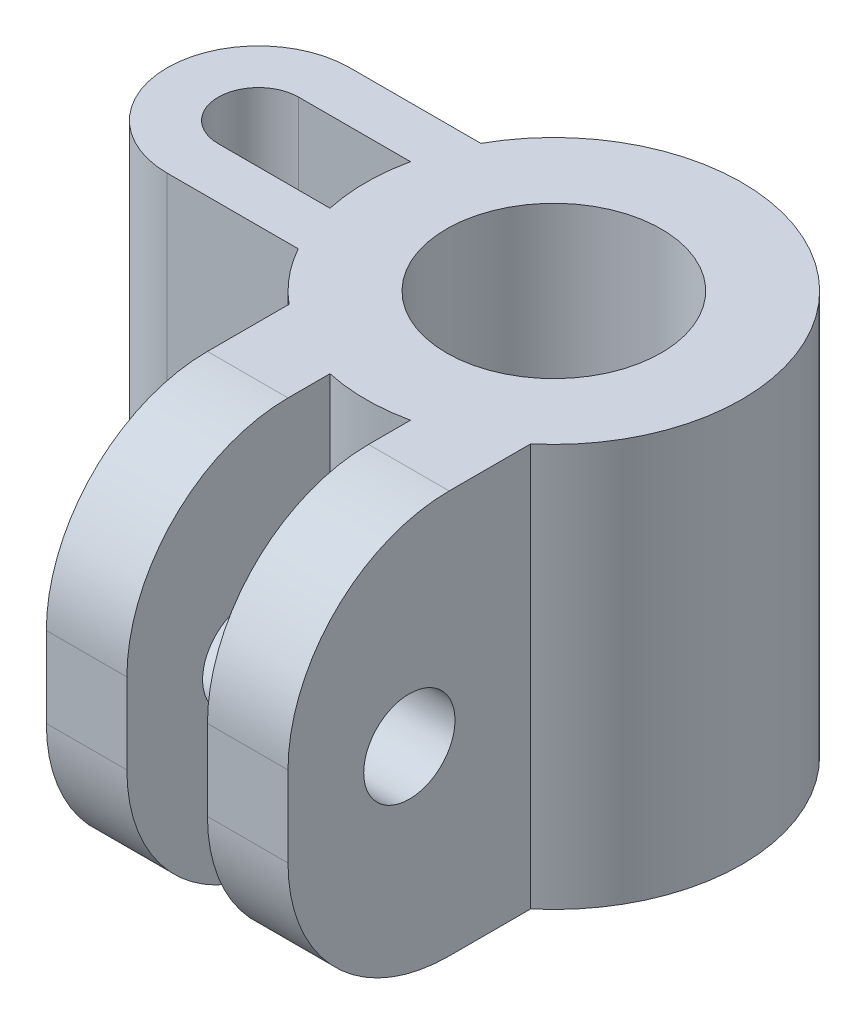
from build123d import *

# Parameters (mm, degrees)
SKETCH1_R                      = 35
SKETCH1_R_2                    = 20
BOSS_EXTRUDE2_DEPTH            = 75
CUT_EXTRUDE1_REACH             = 142.496
SKETCH2_R                      = 8.5
CUT_EXTRUDE1_DIRECTION_2_DEPTH = 141.496441236
FILLET1_R                      = 30


with BuildPart() as part:
    # Sketch1 → Boss-Extrude2 (new body)
    # profile 1 of 4: a face of its own
    with BuildSketch(Plane(origin=(0, 0, 0), x_dir=(1, 0, 0), z_dir=(0, 1, 0))):
        Circle(SKETCH1_R)
        with Locations(Location((0, 0, 0), (0, 0, 270))):
            Circle(SKETCH1_R_2, mode=Mode.SUBTRACT)
    # profile 2 of 4: a face of its own
    with BuildSketch(Plane(origin=(0, 0, 0), x_dir=(1, 0, 0), z_dir=(0, 1, 0))):
        with BuildLine():
            ThreePointArc((-55, 17), (-72, 0), (-55, -17))
            Line((-55, -17), (-30.594117082, -17))
            ThreePointArc((-30.594117082, -17), (-32.736987087, -12.381020816), (-34.186985828, -7.5))
            Line((-34.186985828, -7.5), (-55, -7.5))
            ThreePointArc((-55, -7.5), (-62.5, 0), (-55, 7.5))
            Line((-55, 7.5), (-34.186985828, 7.5))
            ThreePointArc((-34.186985828, 7.5), (-32.736987087, 12.381020816), (-30.594117082, 17))
            Line((-30.594117082, 17), (-55, 17))
        make_face()
    # profile 3 of 4: a face of its own
    with BuildSketch(Plane(origin=(0, 0, 0), x_dir=(1, 0, 0), z_dir=(0, 1, 0))):
        with BuildLine():
            ThreePointArc((-7.5, -34.186985828), (-15.446901808, -31.406897722), (-22.5, -26.809513237))
            Line((-22.5, -26.809513237), (-22.5, -72))
            Line((-22.5, -72), (-7.5, -72))
            Line((-7.5, -72), (-7.5, -34.186985828))
        make_face()
    # profile 4 of 4: a face of its own
    with BuildSketch(Plane(origin=(0, 0, 0), x_dir=(1, 0, 0), z_dir=(0, 1, 0))):
        with BuildLine():
            ThreePointArc((22.5, -26.809513237), (15.446901808, -31.406897722), (7.5, -34.186985828))
            Line((7.5, -34.186985828), (7.5, -72))
            Line((7.5, -72), (22.5, -72))
            Line((22.5, -72), (22.5, -26.809513237))
        make_face()
    extrude(amount=BOSS_EXTRUDE2_DEPTH)

    # Cut-Extrude1: up to this face of the body (flat: up to its plane)
    cut_extrude1_end = Plane(part.part.faces().sort_by_distance((-22.5, 37.5, 49.404756618))[0])
    # Sketch2 → Cut-Extrude1 (cut, up to the picked face)
    with BuildSketch(Plane(origin=(22.5, 0, 0), x_dir=(0, 0, -1), z_dir=(1, 0, 0)), mode=Mode.PRIVATE) as cut_extrude1_sk1:
        with Locations((-49.405, 37.5)):
            Circle(SKETCH2_R)
    cut_extrude1_tool1 = split(extrude(cut_extrude1_sk1.sketch, amount=-CUT_EXTRUDE1_REACH, mode=Mode.PRIVATE), bisect_by=cut_extrude1_end, keep=Keep.BOTH, mode=Mode.PRIVATE)
    add(cut_extrude1_tool1.solids().sort_by(Axis((22.5, 37.5, 49.405), (-1, 0, 0)))[0], mode=Mode.SUBTRACT)

    # Sketch2 → Cut-Extrude1 direction 2 (cut)
    with BuildSketch(Plane(origin=(22.5, 0, 0), x_dir=(0, 0, -1), z_dir=(1, 0, 0))):
        with Locations((-49.405, 37.5)):
            Circle(SKETCH2_R)
    extrude(amount=CUT_EXTRUDE1_DIRECTION_2_DEPTH, mode=Mode.SUBTRACT)

    # Fillet1
    fillet1_edges = [part.edges().sort_by_distance(p)[0] for p in [
        (-15, 0, 72),
        (15, 0, 72),
        (15, 75, 72),
        (-15, 75, 72),
    ]]
    fillet(fillet1_edges, radius=FILLET1_R)


solid = part.part
